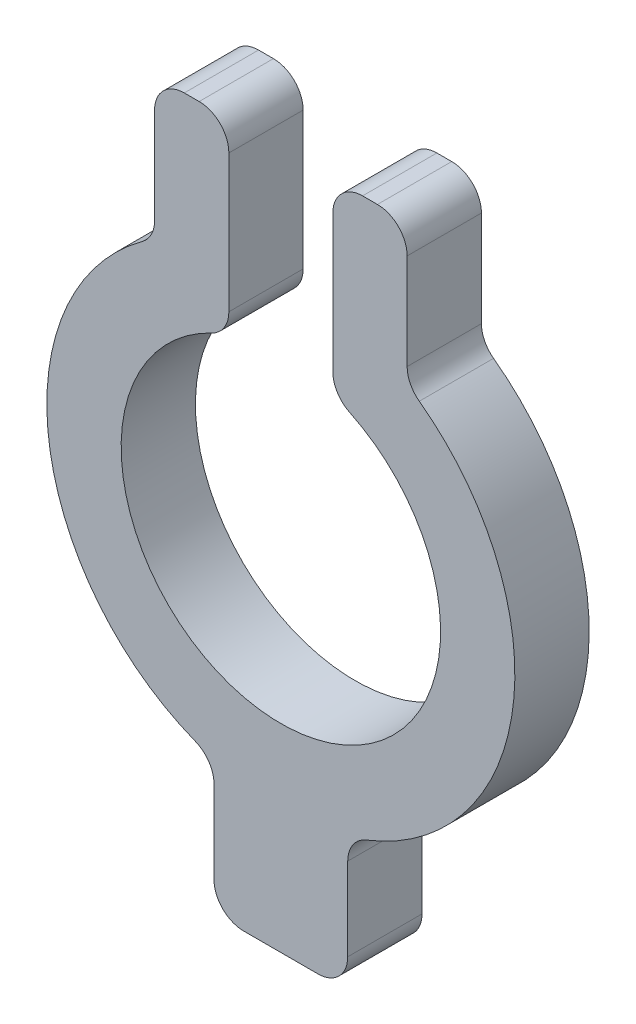
from build123d import *

# Parameters (mm, degrees)
BOSS_EXTRUDE1_DEPTH = 5
FILLET1_R           = 2


with BuildPart() as part:
    # Sketch1 → Boss-Extrude1 (new body)
    with BuildSketch(Plane.XY):
        with BuildLine():
            Line((3.5, 22.759430606), (8.5, 22.759430606))
            Line((8.5, 22.759430606), (8.5, 13.259430606))
            ThreePointArc((8.5, 13.259430606), (15.595562994, -2.200207922), (4.5, -15.093458848))
            Line((4.5, -15.093458848), (4.5, -24.093458848))
            Line((4.5, -24.093458848), (-4.5, -24.093458848))
            Line((-4.5, -24.093458848), (-4.5, -15.093458848))
            ThreePointArc((-4.5, -15.093458848), (-15.595562994, -2.200207922), (-8.5, 13.259430606))
            Line((-8.5, 13.259430606), (-8.5, 22.759430606))
            Line((-8.5, 22.759430606), (-3.5, 22.759430606))
            Line((-3.5, 22.759430606), (-3.5, 10.164275675))
            ThreePointArc((-3.5, 10.164275675), (0, -10.75), (3.5, 10.164275675))
            Line((3.5, 10.164275675), (3.5, 22.759430606))
        make_face()
    extrude(amount=BOSS_EXTRUDE1_DEPTH)

    # Fillet1
    fillet1_edges = [part.edges().sort_by_distance(p)[0] for p in [
        (4.5, -15.093458848, 2.5),
        (4.5, -24.093458848, 2.5),
        (-4.5, -24.093458848, 2.5),
        (-4.5, -15.093458848, 2.5),
        (-8.5, 13.259430606, 2.5),
        (-8.5, 22.759430606, 2.5),
        (-3.5, 22.759430606, 2.5),
        (-3.5, 10.164275675, 2.5),
        (3.5, 10.164275675, 2.5),
        (3.5, 22.759430606, 2.5),
        (8.5, 22.759430606, 2.5),
        (8.5, 13.259430606, 2.5),
    ]]
    fillet(fillet1_edges, radius=FILLET1_R)


solid = part.part
